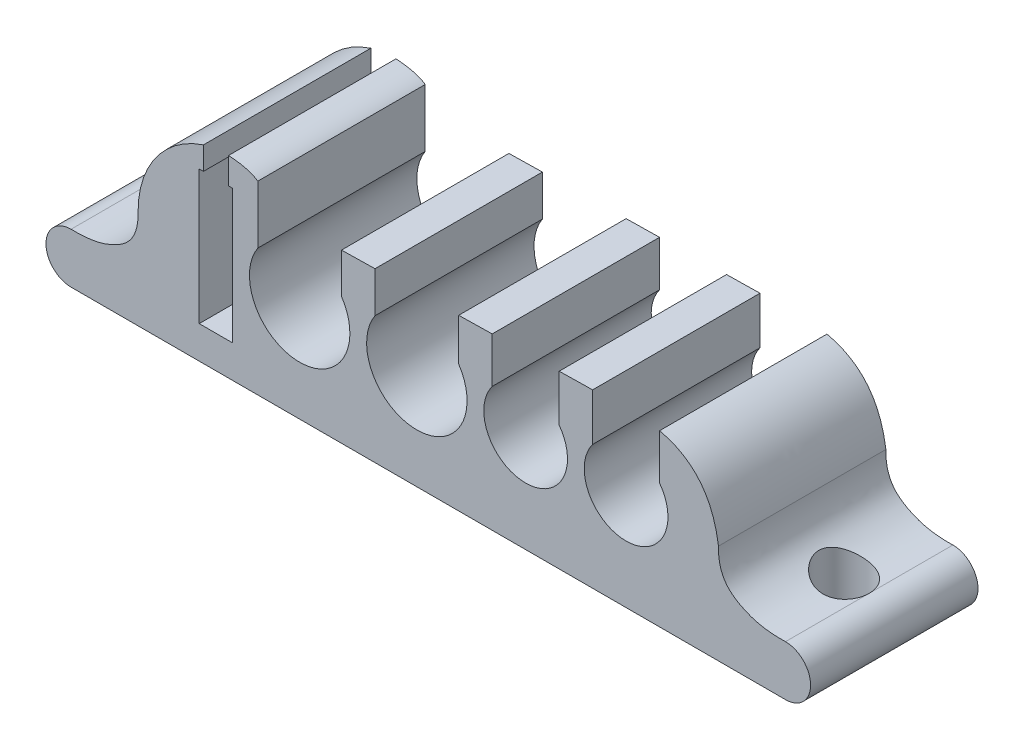
from build123d import *

# Parameters (mm, degrees)
ESBO_O1_W                = 2
ESBO_O1_H                = 8
ESBO_O1_R                = 3
ESBO_O1_R_2              = 2.5
RESSALTO_EXTRUS_O1_DEPTH = 10
ESBO_O4_W                = 4
ESBO_O4_H                = 3.861250687
ESBO_O4_H_2              = 3.752003841
ESBO_O4_W_2              = 5
ESBO_O4_H_3              = 3.819014792
ESBO_O4_H_4              = 3.693699436
ESBO_O4_W_3              = 1.5
ESBO_O4_H_5              = 2.079089953
CORTE_EXTRUS_O1_DEPTH    = 10
ESBO_O5_R                = 1.5
CORTE_EXTRUS_O2_DEPTH    = 10


with BuildPart() as part:
    # Esboço1 → Ressalto-extrusão1 (new body)
    with BuildSketch(Plane.XY):
        with BuildLine():
            Line((-25.719653684, -5.942716093), (-16.131983613, -5.942716093))
            Line((-16.131983613, -5.942716093), (7.368016387, -5.942716093))
            Line((7.368016387, -5.942716093), (16.955686457, -5.942716093))
            ThreePointArc((16.955686457, -5.942716093), (18.455686457, -4.442716093), (16.955686457, -2.942716093))
            add(Edge.make_bspline(
                [(12.952874444, 0), (12.912537119, -1.482141434), (14.266501813, -2.619700333), (15.801098565, -2.968716739), (16.955686457, -2.942716093)],
                knots=[0, 0, 0, 0, 0.504814455, 1, 1, 1, 1], degree=3))
            add(Edge.make_bspline(
                [(12.952874444, 0), (12.309204111, 4.600095009), (7.368016387, 4.358240851)],
                knots=[0, 0, 0, 1, 1, 1], degree=2))
            Line((7.368016387, 4.358240851), (-12.64298655, 4))
            add(Edge.make_bspline(
                [(-12.64298655, 4), (-13.901476132, 4.065275886), (-14.043723736, 5.271225486), (-15.883550882, 5.59671809), (-16.925443363, 5.584858058)],
                knots=[0, 0, 0, 0, 0.56422845, 1, 1, 1, 1], degree=3))
            ThreePointArc((-16.925443363, 5.584858058), (-20.354846171, 3.679270895), (-21.716841671, 0))
            add(Edge.make_bspline(
                [(-21.716841671, 0), (-21.676504345, -1.482141434), (-23.030469039, -2.619700333), (-24.565065791, -2.968716739), (-25.719653684, -2.942716093)],
                knots=[0, 0, 0, 0, 0.504814455, 1, 1, 1, 1], degree=3))
            ThreePointArc((-25.719653684, -2.942716093), (-27.219653684, -4.442716093), (-25.719653684, -5.942716093))
        make_face()
        with Locations((-17.066284799, 0)):
            Rectangle(ESBO_O1_W, ESBO_O1_H, mode=Mode.SUBTRACT)
        with Locations((-12.066284799, 0)):
            Circle(ESBO_O1_R, mode=Mode.SUBTRACT)
        with Locations((-5.066284799, 0)):
            Circle(ESBO_O1_R, mode=Mode.SUBTRACT)
        with Locations((1.433715201, 0)):
            Circle(ESBO_O1_R_2, mode=Mode.SUBTRACT)
        with Locations((7.433715201, 0)):
            Circle(ESBO_O1_R_2, mode=Mode.SUBTRACT)
    extrude(amount=RESSALTO_EXTRUS_O1_DEPTH)

    # Esboço4 → Corte-extrusão1 (cut)
    with BuildSketch(Plane(origin=(0, 0, 0), x_dir=(-1, 0, 0), z_dir=(0, 0, -1))):
        with Locations((-7.433715201, 3.430625344)):
            Rectangle(ESBO_O4_W, ESBO_O4_H)
        with Locations((-1.433715201, 3.376001921)):
            Rectangle(ESBO_O4_W, ESBO_O4_H_2)
        with Locations((5.066284799, 3.567819791)):
            Rectangle(ESBO_O4_W_2, ESBO_O4_H_3)
        with Locations((12.066284799, 3.505162113)):
            Rectangle(ESBO_O4_W_2, ESBO_O4_H_4)
        with Locations((17.066284799, 4.780683053)):
            Rectangle(ESBO_O4_W_3, ESBO_O4_H_5)
    extrude(amount=-CORTE_EXTRUS_O1_DEPTH, mode=Mode.SUBTRACT)

    # Esboço5 → Corte-extrusão2 (cut)
    with BuildSketch(Plane(origin=(0, 0, 0), x_dir=(1, 0, 0), z_dir=(0, 1, 0))):
        with Locations(Location((-24.219653684, -5, 0), (0, 0, 180))):
            Circle(ESBO_O5_R)
        with Locations((15.455686457, -5)):
            Circle(ESBO_O5_R)
    extrude(amount=-CORTE_EXTRUS_O2_DEPTH, mode=Mode.SUBTRACT)


solid = part.part
